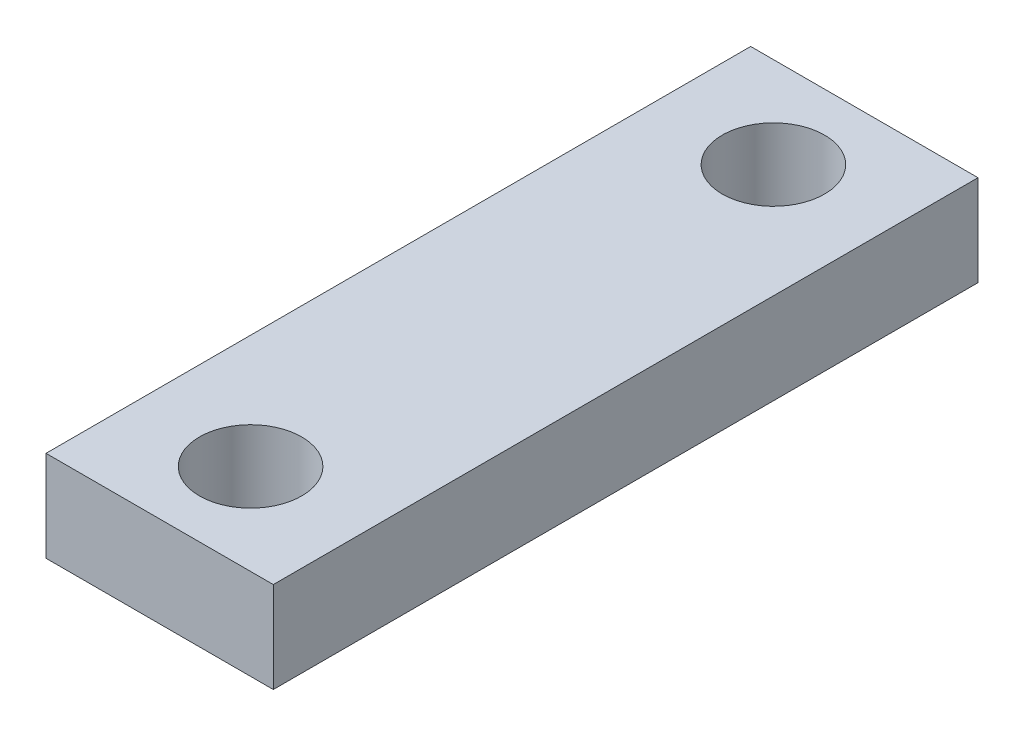
from build123d import *

# Parameters (mm, degrees)
SKETCH1_W           = 10
SKETCH1_H           = 31
SKETCH1_R           = 2.25
BOSS_EXTRUDE1_DEPTH = 4


with BuildPart() as part:
    # Sketch1 → Boss-Extrude1 (new body)
    with BuildSketch(Plane(origin=(0, 0, 0), x_dir=(1, 0, 0), z_dir=(0, 1, 0))):
        Rectangle(SKETCH1_W, SKETCH1_H)
        with Locations(Location((0, 11.5, 0), (0, 0, 270))):
            Circle(SKETCH1_R, mode=Mode.SUBTRACT)
        with Locations(Location((0, -11.5, 0), (0, 0, 270))):
            Circle(SKETCH1_R, mode=Mode.SUBTRACT)
    extrude(amount=BOSS_EXTRUDE1_DEPTH)


solid = part.part
